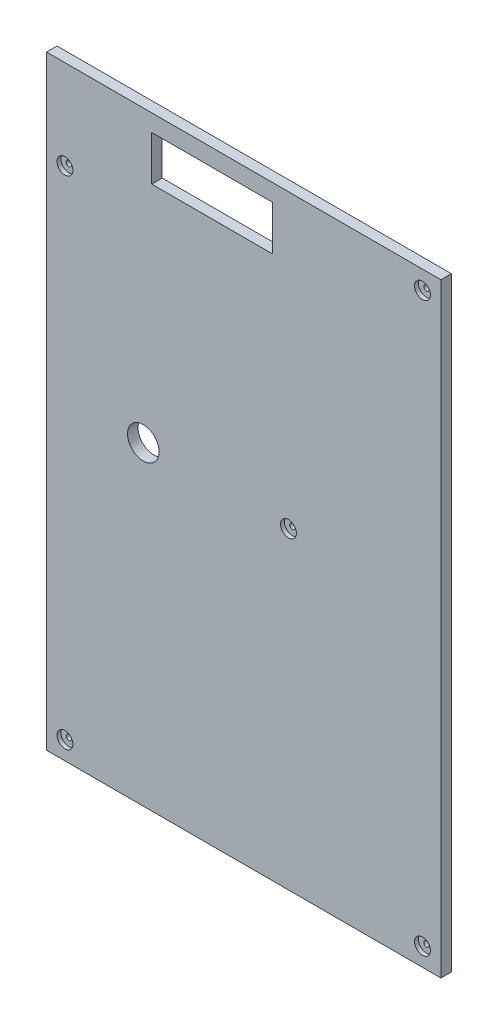
from build123d import *

# Parameters (mm, degrees)
SKETCH1_W                      = 150
SKETCH1_H                      = 230
BOSS_EXTRUDE1_DEPTH            = 4
TAP_DRILL_FOR_M2_5X0_45_TAP2_D = 2.05
SKETCH8_R                      = 3.025
CUT_EXTRUDE2_DEPTH             = 1.5
CUT_EXTRUDE3_REACH             = 139.354
SKETCH9_W                      = 46
SKETCH9_H                      = 17
CUT_EXTRUDE3_DIRECTION_2_DEPTH = 138.353558381
CUT_EXTRUDE4_REACH             = 139.354
SKETCH10_R                     = 6


with BuildPart() as part:
    # Sketch1 → Boss-Extrude1 (new body)
    with BuildSketch(Plane.XY):
        Rectangle(SKETCH1_W, SKETCH1_H)
    extrude(amount=BOSS_EXTRUDE1_DEPTH)

    # Tap Drill for M2.5x0.45 Tap2 (through all)
    with Locations(Plane(origin=(68, 108, 0), x_dir=(-1, 0, 0), z_dir=(0, 0, -1))):
        with Locations((0, 0), (136, -27), (0, -216), (136, -216), (51, -104)):
            Hole(TAP_DRILL_FOR_M2_5X0_45_TAP2_D / 2)

    # Sketch8 → Cut-Extrude2 (cut)
    with BuildSketch(Plane.XY.offset(4)):
        with Locations((-68, 81)):
            Circle(SKETCH8_R)
        with Locations((68, 108)):
            Circle(SKETCH8_R)
        with Locations((-68, -108)):
            Circle(SKETCH8_R)
        with Locations((68, -108)):
            Circle(SKETCH8_R)
        with Locations((17, 4)):
            Circle(SKETCH8_R)
    extrude(amount=-CUT_EXTRUDE2_DEPTH, mode=Mode.SUBTRACT)

    # Sketch9 → Cut-Extrude3 (cut, up to next)
    with BuildSketch(Plane.XY.offset(4), mode=Mode.PRIVATE) as cut_extrude3_sk1:
        with Locations((-12, 100)):
            Rectangle(SKETCH9_W, SKETCH9_H)
    cut_extrude3_tool1 = extrude(cut_extrude3_sk1.sketch, amount=-CUT_EXTRUDE3_REACH, mode=Mode.PRIVATE) & part.part
    add(cut_extrude3_tool1.solids().sort_by_distance((-12, 100, 4))[0], mode=Mode.SUBTRACT)

    # Sketch9 → Cut-Extrude3 direction 2 (cut)
    with BuildSketch(Plane.XY.offset(4)):
        with Locations((-12, 100)):
            Rectangle(SKETCH9_W, SKETCH9_H)
    extrude(amount=CUT_EXTRUDE3_DIRECTION_2_DEPTH, mode=Mode.SUBTRACT)

    # Sketch10 → Cut-Extrude4 (cut, up to next)
    with BuildSketch(Plane.XY.offset(4), mode=Mode.PRIVATE) as cut_extrude4_sk1:
        with Locations((-38.202297392, 4.692384057)):
            Circle(SKETCH10_R)
    cut_extrude4_tool1 = extrude(cut_extrude4_sk1.sketch, amount=-CUT_EXTRUDE4_REACH, mode=Mode.PRIVATE) & part.part
    add(cut_extrude4_tool1.solids().sort_by_distance((-38.202297, 4.692384, 4))[0], mode=Mode.SUBTRACT)


solid = part.part
